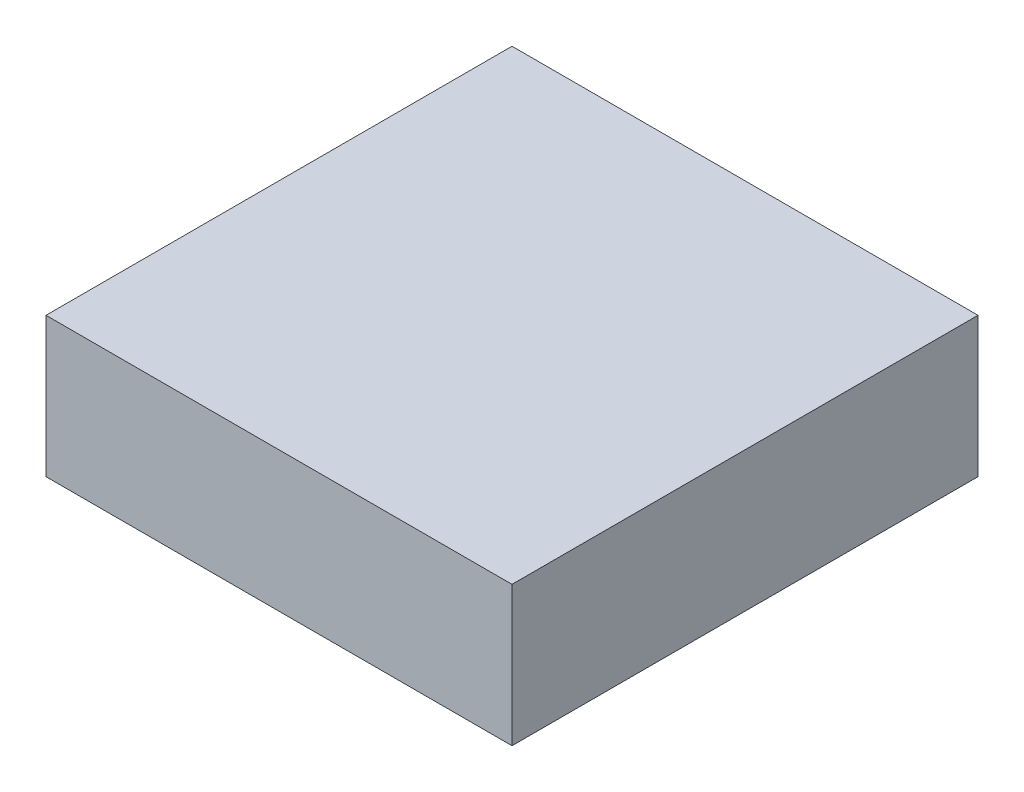
from build123d import *

# Parameters (mm, degrees)
CROQUIS1_W              = 500
CROQUIS1_H              = 500
SALIENTE_EXTRUIR1_DEPTH = 150


with BuildPart() as part:
    # Croquis1 → Saliente-Extruir1 (new body)
    with BuildSketch(Plane(origin=(0, 0, 0), x_dir=(1, 0, 0), z_dir=(0, 1, 0))):
        Rectangle(CROQUIS1_W, CROQUIS1_H)
    extrude(amount=SALIENTE_EXTRUIR1_DEPTH)


solid = part.part
